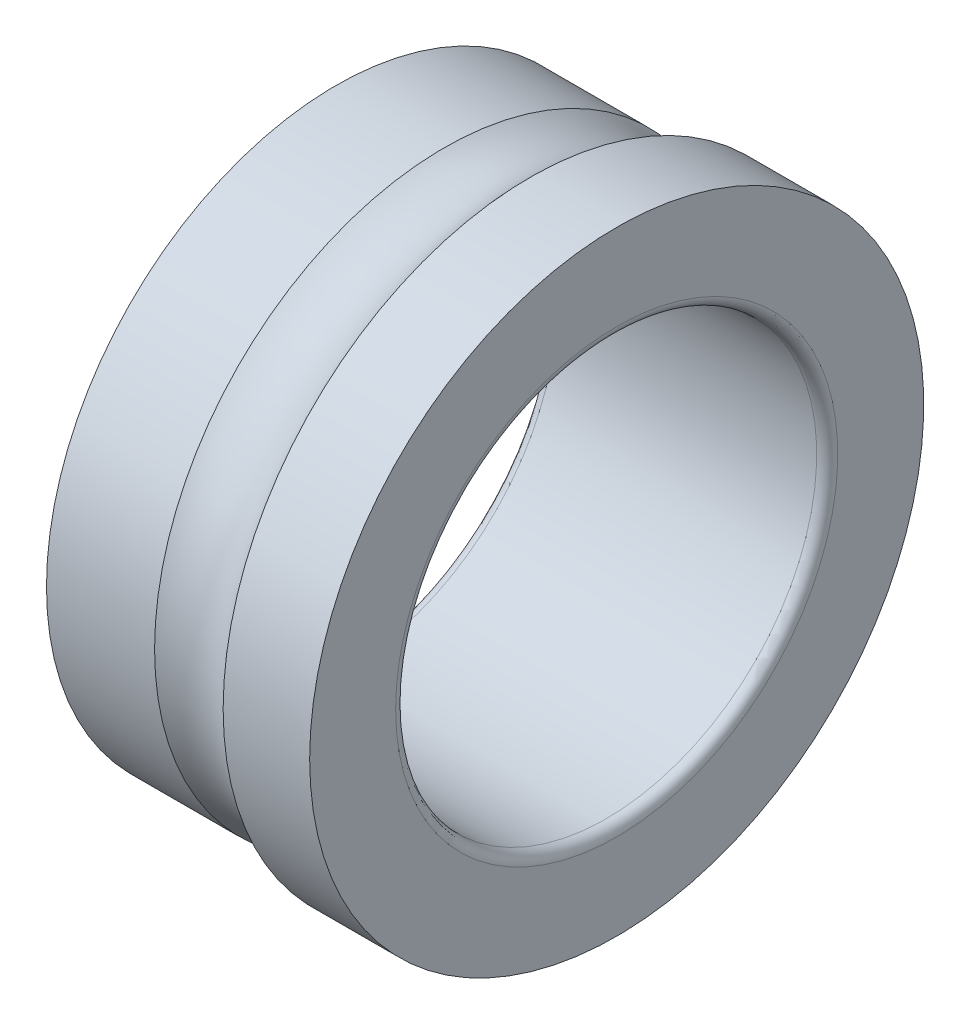
from build123d import *


with BuildPart() as part:
    # Sketch1 → Revolve1 (revolve)
    with BuildSketch(Plane.XY, mode=Mode.PRIVATE) as revolve1_sk:
        with BuildLine():
            Line((-3.7, 6), (3.7, 6))
            ThreePointArc((3.7, 6), (3.912132034, 6.087867966), (4, 6.3))
            Line((4, 6.3), (4, 8.75))
            Line((4, 8.75), (1.534411288, 8.75))
            ThreePointArc((1.534411288, 8.75), (0.396176489, 8.063947496), (-0.919738006, 8.25))
            Line((-0.919738006, 8.25), (-4, 8.25))
            Line((-4, 8.25), (-4, 6.3))
            ThreePointArc((-4, 6.3), (-3.912132034, 6.087867966), (-3.7, 6))
        make_face()
    revolve(revolve1_sk.sketch.rotate(Axis((4, 0, 0), (-1, 0, 0)), 270), axis=Axis((4, 0, 0), (-1, 0, 0)))


solid = part.part
